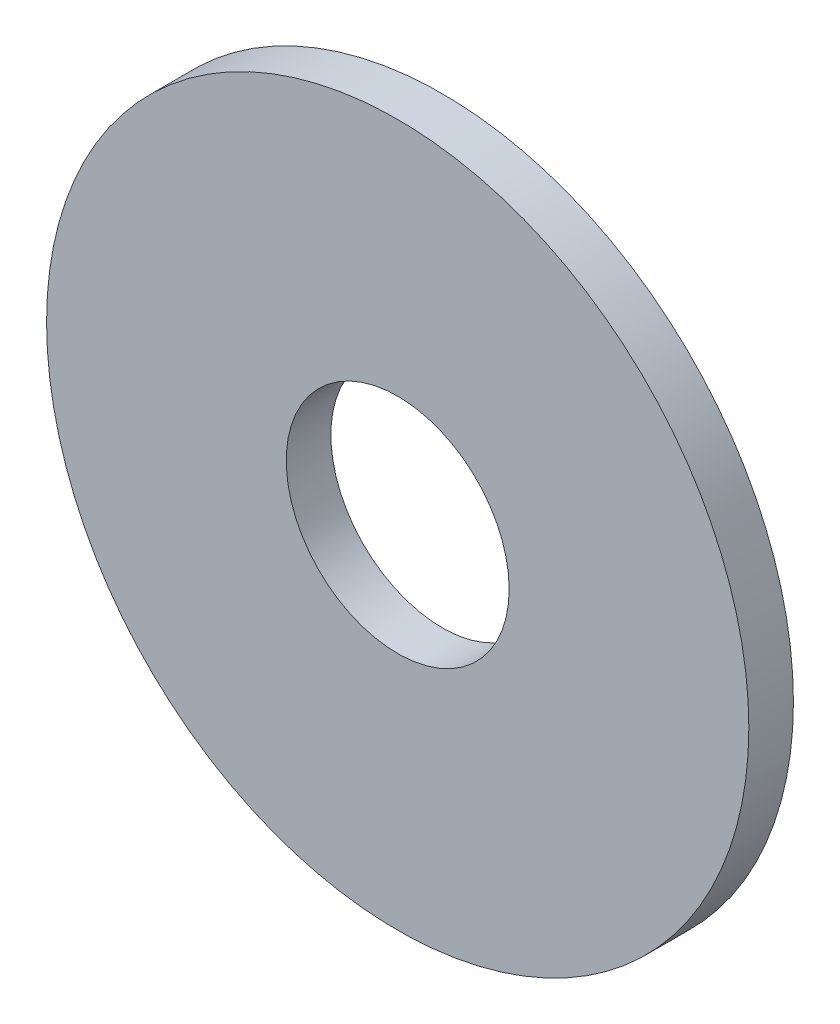
from build123d import *

# Parameters (mm, degrees)
SKETCH1_R           = 7.875
SKETCH1_R_2         = 2.5
BOSS_EXTRUDE1_DEPTH = 1


with BuildPart() as part:
    # Sketch1 → Boss-Extrude1 (new body)
    with BuildSketch(Plane.XY):
        with Locations((-13.491894543, 17.954598123)):
            Circle(SKETCH1_R)
        with Locations((-13.491894543, 17.954598123)):
            Circle(SKETCH1_R_2, mode=Mode.SUBTRACT)
    extrude(amount=BOSS_EXTRUDE1_DEPTH)


solid = part.part
